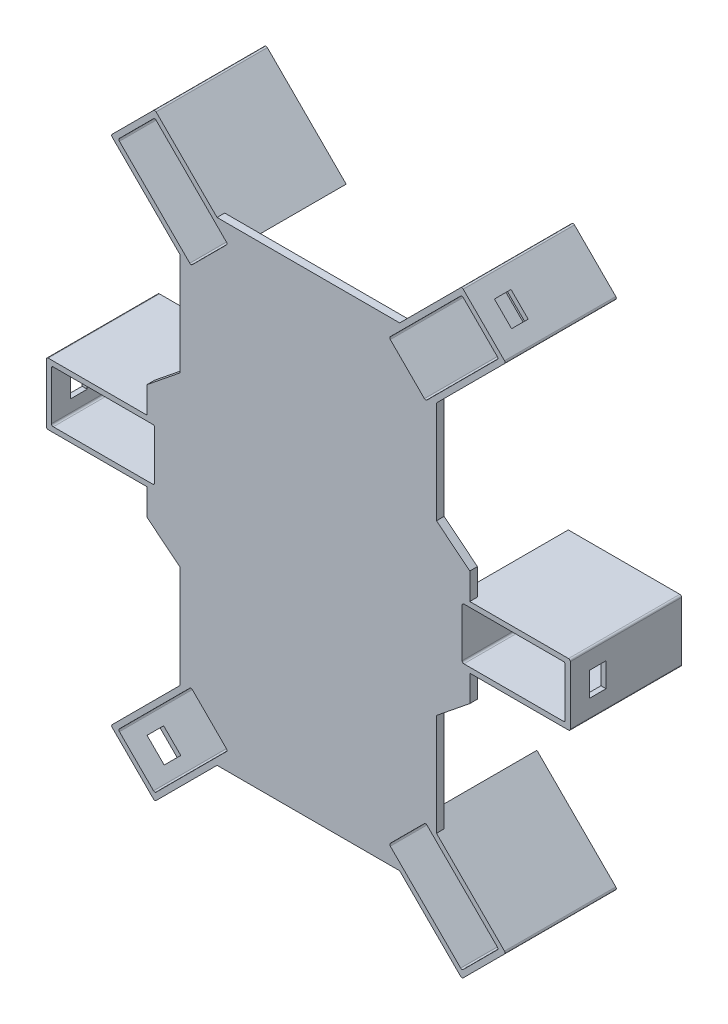
from build123d import *

# Parameters (mm, degrees)
SKETCH_1_W          = 44.4
SKETCH_1_H          = 24.3
SKETCH_1_W_2        = 40.4
SKETCH_1_H_2        = 20.3
EXTRUDE_5_DEPTH     = 42
EXTRUDE_5_2_DEPTH   = 42
EXTRUDE_6_DEPTH     = 42
EXTRUDE_6_2_DEPTH   = 42
EXTRUDE_6_3_DEPTH   = 42
EXTRUDE_6_4_DEPTH   = 42
SKETCH_6_R          = 6.75
SKETCH_6_R_2        = 0.8
SKETCH_6_W          = 44.4
SKETCH_6_H          = 24.3
EXTRUDE_8_DEPTH     = 1.6
FILLET_1_R          = 0.7
FILLET_2_R          = 0.7
FILLET_3_R          = 0.7
FILLET_4_R          = 0.7
FILLET_5_R          = 0.7
FILLET_6_R          = 0.7
SKETCH_7_R          = 2
CUT_EXTRUDE_2_DEPTH = 0.7
SKETCH_8_W          = 6.5
SKETCH_8_H          = 9.5
CUT_EXTRUDE_3_DEPTH = 9.8
SKETCH_9_W          = 6.5
SKETCH_9_H          = 9.5
CUT_EXTRUDE_4_DEPTH = 9.8
SKETCH_10_W         = 6.5
SKETCH_10_H         = 9.5
CUT_EXTRUDE_5_DEPTH = 9.8
SKETCH_11_W         = 6.5
SKETCH_11_H         = 9.5
CUT_EXTRUDE_6_DEPTH = 9.8
SKETCH_12_W         = 6.5
SKETCH_12_H         = 9.5
CUT_EXTRUDE_7_DEPTH = 9.8
SKETCH_13_W         = 6.5
SKETCH_13_H         = 9.5
CUT_EXTRUDE_8_DEPTH = 9.8
FILLET_7_R          = 0.7
FILLET_8_R          = 0.7
FILLET_9_R          = 0.7
FILLET_10_R         = 0.7
FILLET_11_R         = 0.7
FILLET_12_R         = 0.7
EXTRUDE_9_DEPTH     = 3
EXTRUDE_11_DEPTH    = 3
EXTRUDE_12_DEPTH    = 3
EXTRUDE_START       = -3
EXTRUDE_13_DEPTH    = 3


with BuildPart() as part:
    # 草图1 → 凸台-拉伸5 (new body)
    with BuildSketch(Plane.XY):
        with Locations((80.45, 0)):
            Rectangle(SKETCH_1_W, SKETCH_1_H)
        with Locations((80.45, 0)):
            Rectangle(SKETCH_1_W_2, SKETCH_1_H_2, mode=Mode.SUBTRACT)
    extrude(amount=EXTRUDE_5_DEPTH)



with BuildPart() as body_2:
    # 草图1 → Extrude 5 2 (new body)
    with BuildSketch(Plane.XY):
        with Locations((-80.45, 0)):
            Rectangle(SKETCH_1_W, SKETCH_1_H)
        with Locations((-80.45, 0)):
            Rectangle(SKETCH_1_W_2, SKETCH_1_H_2, mode=Mode.SUBTRACT)
    extrude(amount=EXTRUDE_5_2_DEPTH)


with BuildPart() as body_3:
    # 草图5 → 凸台-拉伸6 (new body)
    with BuildSketch(Plane.XY):
        Polygon((28.782128445, 85.964823228), (60.17766953, 117.360364312), (77.360364312, 100.17766953), (45.964823228, 68.782128445), align=None)
        Polygon((60.17766953, 114.531937188), (74.531937188, 100.17766953), (45.964823228, 71.61055557), (31.61055557, 85.964823228), align=None, mode=Mode.SUBTRACT)
    extrude(amount=EXTRUDE_6_DEPTH)


with BuildPart() as body_4:
    # 草图5 → Extrude 6 2 (new body)
    with BuildSketch(Plane.XY):
        Polygon((45.964823228, -68.782128445), (28.782128445, -85.964823228), (60.17766953, -117.360364312), (77.360364312, -100.17766953), align=None)
        Polygon((31.61055557, -85.964823228), (60.17766953, -114.531937188), (74.531937188, -100.17766953), (45.964823228, -71.61055557), align=None, mode=Mode.SUBTRACT)
    extrude(amount=EXTRUDE_6_2_DEPTH)


with BuildPart() as body_5:
    # 草图5 → Extrude 6 3 (new body)
    with BuildSketch(Plane.XY):
        Polygon((-28.782128445, -85.964823228), (-60.17766953, -117.360364312), (-77.360364312, -100.17766953), (-45.964823228, -68.782128445), align=None)
        Polygon((-60.17766953, -114.531937188), (-74.531937188, -100.17766953), (-45.964823228, -71.61055557), (-31.61055557, -85.964823228), align=None, mode=Mode.SUBTRACT)
    extrude(amount=EXTRUDE_6_3_DEPTH)


with BuildPart() as body_6:
    # 草图5 → Extrude 6 4 (new body)
    with BuildSketch(Plane.XY):
        Polygon((-45.964823228, 68.782128445), (-28.782128445, 85.964823228), (-60.17766953, 117.360364312), (-77.360364312, 100.17766953), align=None)
        Polygon((-31.61055557, 85.964823228), (-60.17766953, 114.531937188), (-74.531937188, 100.17766953), (-45.964823228, 71.61055557), align=None, mode=Mode.SUBTRACT)
    extrude(amount=EXTRUDE_6_4_DEPTH)


with BuildPart() as part_1:
    add(part.part)

    add(body_2.part)  # 凸台-拉伸8 merges body 2

    add(body_3.part)  # 凸台-拉伸8 merges body 3

    add(body_4.part)  # 凸台-拉伸8 merges body 4

    add(body_5.part)  # 凸台-拉伸8 merges body 5

    add(body_6.part)  # 凸台-拉伸8 merges body 6
    # 草图6 → 凸台-拉伸8 (add)
    # profile 1 of 6: a face of its own
    with BuildSketch(Plane(origin=(0, 0, 0), x_dir=(-1, 0, 0), z_dir=(0, 0, -1))):
        Polygon((-77.360364312, 100.17766953), (-60.17766953, 117.360364312), (-28.782128445, 85.964823228), (-45.964823228, 68.782128445), align=None)
        with Locations((-60.17766953, 100.17766953)):
            Circle(SKETCH_6_R, mode=Mode.SUBTRACT)
        with Locations((-61.026197667, 89.712489168)):
            Circle(SKETCH_6_R_2, mode=Mode.SUBTRACT)
        with Locations((-50.971139239, 81.071644302)):
            Circle(SKETCH_6_R_2, mode=Mode.SUBTRACT)
        with Locations((-41.071644302, 81.071644302)):
            Circle(SKETCH_6_R_2, mode=Mode.SUBTRACT)
        with Locations(Location((-41.071644302, 90.971139239, 0), (0, 0, 180))):
            Circle(SKETCH_6_R_2, mode=Mode.SUBTRACT)
        with Locations(Location((-49.712489168, 101.026197667, 0), (0, 0, 180))):
            Circle(SKETCH_6_R_2, mode=Mode.SUBTRACT)
    # profile 2 of 6: a face of its own
    with BuildSketch(Plane(origin=(0, 0, 0), x_dir=(-1, 0, 0), z_dir=(0, 0, -1))):
        with Locations((-80.45, 0)):
            Rectangle(SKETCH_6_W, SKETCH_6_H)
        with Locations((-70.48, -7)):
            Circle(SKETCH_6_R_2, mode=Mode.SUBTRACT)
        with Locations((-63.48, 0)):
            Circle(SKETCH_6_R_2, mode=Mode.SUBTRACT)
        with Locations((-90.5, 0)):
            Circle(SKETCH_6_R, mode=Mode.SUBTRACT)
        with Locations((-83.7, -8)):
            Circle(SKETCH_6_R_2, mode=Mode.SUBTRACT)
        with Locations(Location((-70.48, 7, 0), (0, 0, 180))):
            Circle(SKETCH_6_R_2, mode=Mode.SUBTRACT)
        with Locations(Location((-83.7, 8, 0), (0, 0, 180))):
            Circle(SKETCH_6_R_2, mode=Mode.SUBTRACT)
    # profile 3 of 6: a face of its own
    with BuildSketch(Plane(origin=(0, 0, 0), x_dir=(-1, 0, 0), z_dir=(0, 0, -1))):
        Polygon((-45.964823228, -68.782128445), (-77.360364312, -100.17766953), (-60.17766953, -117.360364312), (-28.782128445, -85.964823228), align=None)
        with Locations((-49.712489168, -101.026197667)):
            Circle(SKETCH_6_R_2, mode=Mode.SUBTRACT)
        with Locations((-41.071644302, -90.971139239)):
            Circle(SKETCH_6_R_2, mode=Mode.SUBTRACT)
        with Locations(Location((-41.071644302, -81.071644302, 0), (0, 0, 180))):
            Circle(SKETCH_6_R_2, mode=Mode.SUBTRACT)
        with Locations(Location((-50.971139239, -81.071644302, 0), (0, 0, 180))):
            Circle(SKETCH_6_R_2, mode=Mode.SUBTRACT)
        with Locations(Location((-61.026197667, -89.712489168, 0), (0, 0, 180))):
            Circle(SKETCH_6_R_2, mode=Mode.SUBTRACT)
        with Locations(Location((-60.17766953, -100.17766953, 0), (0, 0, 180))):
            Circle(SKETCH_6_R, mode=Mode.SUBTRACT)
    # profile 4 of 6: a face of its own
    with BuildSketch(Plane(origin=(0, 0, 0), x_dir=(-1, 0, 0), z_dir=(0, 0, -1))):
        Polygon((77.360364312, -100.17766953), (60.17766953, -117.360364312), (28.782128445, -85.964823228), (45.964823228, -68.782128445), align=None)
        with Locations((60.17766953, -100.17766953)):
            Circle(SKETCH_6_R, mode=Mode.SUBTRACT)
        with Locations((61.026197667, -89.712489168)):
            Circle(SKETCH_6_R_2, mode=Mode.SUBTRACT)
        with Locations((50.971139239, -81.071644302)):
            Circle(SKETCH_6_R_2, mode=Mode.SUBTRACT)
        with Locations((41.071644302, -81.071644302)):
            Circle(SKETCH_6_R_2, mode=Mode.SUBTRACT)
        with Locations(Location((41.071644302, -90.971139239, 0), (0, 0, 180))):
            Circle(SKETCH_6_R_2, mode=Mode.SUBTRACT)
        with Locations(Location((49.712489168, -101.026197667, 0), (0, 0, 180))):
            Circle(SKETCH_6_R_2, mode=Mode.SUBTRACT)
    # profile 5 of 6: a face of its own
    with BuildSketch(Plane(origin=(0, 0, 0), x_dir=(-1, 0, 0), z_dir=(0, 0, -1))):
        with Locations((80.45, 0)):
            Rectangle(SKETCH_6_W, SKETCH_6_H)
        with Locations((83.7, 8)):
            Circle(SKETCH_6_R_2, mode=Mode.SUBTRACT)
        with Locations((70.48, 7)):
            Circle(SKETCH_6_R_2, mode=Mode.SUBTRACT)
        with Locations(Location((83.7, -8, 0), (0, 0, 180))):
            Circle(SKETCH_6_R_2, mode=Mode.SUBTRACT)
        with Locations(Location((90.5, 0, 0), (0, 0, 180))):
            Circle(SKETCH_6_R, mode=Mode.SUBTRACT)
        with Locations(Location((63.48, 0, 0), (0, 0, 180))):
            Circle(SKETCH_6_R_2, mode=Mode.SUBTRACT)
        with Locations(Location((70.48, -7, 0), (0, 0, 180))):
            Circle(SKETCH_6_R_2, mode=Mode.SUBTRACT)
    # profile 6 of 6: a face of its own
    with BuildSketch(Plane(origin=(0, 0, 0), x_dir=(-1, 0, 0), z_dir=(0, 0, -1))):
        Polygon((45.964823228, 68.782128445), (77.360364312, 100.17766953), (60.17766953, 117.360364312), (28.782128445, 85.964823228), align=None)
        with Locations((49.712489168, 101.026197667)):
            Circle(SKETCH_6_R_2, mode=Mode.SUBTRACT)
        with Locations((41.071644302, 90.971139239)):
            Circle(SKETCH_6_R_2, mode=Mode.SUBTRACT)
        with Locations(Location((41.071644302, 81.071644302, 0), (0, 0, 180))):
            Circle(SKETCH_6_R_2, mode=Mode.SUBTRACT)
        with Locations(Location((50.971139239, 81.071644302, 0), (0, 0, 180))):
            Circle(SKETCH_6_R_2, mode=Mode.SUBTRACT)
        with Locations(Location((61.026197667, 89.712489168, 0), (0, 0, 180))):
            Circle(SKETCH_6_R_2, mode=Mode.SUBTRACT)
        with Locations(Location((60.17766953, 100.17766953, 0), (0, 0, 180))):
            Circle(SKETCH_6_R, mode=Mode.SUBTRACT)
    extrude(amount=EXTRUDE_8_DEPTH)

    # 圆角1
    fillet_1_edges = [part_1.edges().sort_by_distance(p)[0] for p in [
        (60.17766953, 114.531937188, 21),
        (31.61055557, 85.964823228, 21),
        (45.964823228, 71.61055557, 21),
        (74.531937188, 100.17766953, 21),
    ]]
    fillet(fillet_1_edges, radius=FILLET_1_R)

    # 圆角2
    fillet_2_edges = [part_1.edges().sort_by_distance(p)[0] for p in [
        (-60.17766953, 114.531937188, 21),
        (-74.531937188, 100.17766953, 21),
        (-45.964823228, 71.61055557, 21),
        (-31.61055557, 85.964823228, 21),
    ]]
    fillet(fillet_2_edges, radius=FILLET_2_R)

    # 圆角3
    fillet_3_edges = [part_1.edges().sort_by_distance(p)[0] for p in [
        (-100.65, 10.15, 21),
        (-100.65, -10.15, 21),
        (-60.25, -10.15, 21),
        (-60.25, 10.15, 21),
    ]]
    fillet(fillet_3_edges, radius=FILLET_3_R)

    # 圆角4
    fillet_4_edges = [part_1.edges().sort_by_distance(p)[0] for p in [
        (-60.17766953, -114.531937188, 21),
        (-31.61055557, -85.964823228, 21),
        (-45.964823228, -71.61055557, 21),
        (-74.531937188, -100.17766953, 21),
    ]]
    fillet(fillet_4_edges, radius=FILLET_4_R)

    # 圆角5
    fillet_5_edges = [part_1.edges().sort_by_distance(p)[0] for p in [
        (60.17766953, -114.531937188, 21),
        (74.531937188, -100.17766953, 21),
        (45.964823228, -71.61055557, 21),
        (31.61055557, -85.964823228, 21),
    ]]
    fillet(fillet_5_edges, radius=FILLET_5_R)

    # 圆角6
    fillet_6_edges = [part_1.edges().sort_by_distance(p)[0] for p in [
        (60.25, 10.15, 21),
        (60.25, -10.15, 21),
        (100.65, -10.15, 21),
        (100.65, 10.15, 21),
    ]]
    fillet(fillet_6_edges, radius=FILLET_6_R)

    # 草图7 → 切除-拉伸2 (cut)
    with BuildSketch(Plane(origin=(0, 0, -1.6), x_dir=(-1, 0, 0), z_dir=(0, 0, -1))):
        with Locations((83.7, 8)):
            Circle(SKETCH_7_R)
        with Locations((83.7, -8)):
            Circle(SKETCH_7_R)
        with Locations((61.026197667, -89.712489168)):
            Circle(SKETCH_7_R)
        with Locations((49.712489168, -101.026197667)):
            Circle(SKETCH_7_R)
        with Locations(Location((-49.712489168, -101.026197667, 0), (0, 0, 180))):
            Circle(SKETCH_7_R)
        with Locations(Location((-61.026197667, -89.712489168, 0), (0, 0, 180))):
            Circle(SKETCH_7_R)
        with Locations(Location((-83.7, -8, 0), (0, 0, 180))):
            Circle(SKETCH_7_R)
        with Locations(Location((-83.7, 8, 0), (0, 0, 180))):
            Circle(SKETCH_7_R)
        with Locations((-61.026197667, 89.712489168)):
            Circle(SKETCH_7_R)
        with Locations((-49.712489168, 101.026197667)):
            Circle(SKETCH_7_R)
        with Locations((49.712489168, 101.026197667)):
            Circle(SKETCH_7_R)
        with Locations((61.026197667, 89.712489168)):
            Circle(SKETCH_7_R)
    extrude(amount=-CUT_EXTRUDE_2_DEPTH, mode=Mode.SUBTRACT)

    # 草图8 → 切除-拉伸3 (cut)
    with BuildSketch(Plane(origin=(-88.769016921, -88.769016921, 0), x_dir=(0, 0, 1), z_dir=(-0.7071067811865477, -0.7071067811865475, 0))):
        with Locations((31.25, -28.284271247)):
            Rectangle(SKETCH_8_W, SKETCH_8_H)
    extrude(amount=-CUT_EXTRUDE_3_DEPTH, mode=Mode.SUBTRACT)

    # 草图9 → 切除-拉伸4 (cut)
    with BuildSketch(Plane.ZY.offset(102.65)):
        with Locations((31.25, 0)):
            Rectangle(SKETCH_9_W, SKETCH_9_H)
    extrude(amount=-CUT_EXTRUDE_4_DEPTH, mode=Mode.SUBTRACT)

    # 草图10 → 切除-拉伸5 (cut)
    with BuildSketch(Plane(origin=(-88.769016921, 88.769016921, 0), x_dir=(0, 0, 1), z_dir=(-0.7071067811865477, 0.7071067811865475, 0))):
        with Locations((31.25, 28.305878323)):
            Rectangle(SKETCH_10_W, SKETCH_10_H)
    extrude(amount=-CUT_EXTRUDE_5_DEPTH, mode=Mode.SUBTRACT)

    # 草图11 → 切除-拉伸6 (cut)
    with BuildSketch(Plane(origin=(88.769016921, 88.769016921, 0), x_dir=(0, 0, -1), z_dir=(0.7071067811865477, 0.7071067811865475, 0))):
        with Locations((-31.25, 28.284271247)):
            Rectangle(SKETCH_11_W, SKETCH_11_H)
    extrude(amount=-CUT_EXTRUDE_6_DEPTH, mode=Mode.SUBTRACT)

    # 草图12 → 切除-拉伸7 (cut)
    with BuildSketch(Plane(origin=(102.65, 0, 0), x_dir=(0, 0, -1), z_dir=(1, 0, 0))):
        with Locations((-31.25, 0)):
            Rectangle(SKETCH_12_W, SKETCH_12_H)
    extrude(amount=-CUT_EXTRUDE_7_DEPTH, mode=Mode.SUBTRACT)

    # 草图13 → 切除-拉伸8 (cut)
    with BuildSketch(Plane(origin=(88.769016921, -88.769016921, 0), x_dir=(0, 0, -1), z_dir=(0.7071067811865477, -0.7071067811865475, 0))):
        with Locations((-31.25, -28.284271247)):
            Rectangle(SKETCH_13_W, SKETCH_13_H)
    extrude(amount=-CUT_EXTRUDE_8_DEPTH, mode=Mode.SUBTRACT)

    # 圆角7
    fillet_7_edges = [part_1.edges().sort_by_distance(p)[0] for p in [
        (-77.360364312, 100.17766953, 20.2),
        (-60.17766953, 117.360364312, 20.2),
    ]]
    fillet(fillet_7_edges, radius=FILLET_7_R)

    # 圆角8
    fillet_8_edges = [part_1.edges().sort_by_distance(p)[0] for p in [
        (-102.65, -12.15, 20.2),
        (-102.65, 12.15, 20.2),
    ]]
    fillet(fillet_8_edges, radius=FILLET_8_R)

    # 圆角9
    fillet_9_edges = [part_1.edges().sort_by_distance(p)[0] for p in [
        (-60.17766953, -117.360364312, 20.2),
        (-77.360364312, -100.17766953, 20.2),
    ]]
    fillet(fillet_9_edges, radius=FILLET_9_R)

    # 圆角10
    fillet_10_edges = [part_1.edges().sort_by_distance(p)[0] for p in [
        (77.360364312, -100.17766953, 20.2),
        (60.17766953, -117.360364312, 20.2),
    ]]
    fillet(fillet_10_edges, radius=FILLET_10_R)

    # 圆角11
    fillet_11_edges = [part_1.edges().sort_by_distance(p)[0] for p in [
        (102.65, 12.15, 20.2),
        (102.65, -12.15, 20.2),
    ]]
    fillet(fillet_11_edges, radius=FILLET_11_R)

    # 圆角12
    fillet_12_edges = [part_1.edges().sort_by_distance(p)[0] for p in [
        (60.17766953, 117.360364312, 20.2),
        (77.360364312, 100.17766953, 20.2),
    ]]
    fillet(fillet_12_edges, radius=FILLET_12_R)

    # 草图14 → 凸台-拉伸9 (add)
    with BuildSketch(Plane.XY.offset(42)):
        Polygon((58.25, 12.15), (42.5, 24.862562051), (42.5, 65.317305217), (45.964823228, 68.782128445), (28.782128445, 85.964823228), (25.317305217, 82.5), (-25.317305217, 82.5), (-28.782128445, 85.964823228), (-45.964823228, 68.782128445), (-42.5, 65.317305217), (-42.5, 24.862562051), (-58.25, 12.15), (-58.25, -12.15), (-42.5, -24.862562051), (-42.5, -65.317305217), (-45.964823228, -68.782128445), (-28.782128445, -85.964823228), (-25.317305217, -82.5), (25.317305217, -82.5), (28.782128445, -85.964823228), (45.964823228, -68.782128445), (42.5, -65.317305217), (42.5, -24.862562051), (58.25, -12.15), align=None)
    extrude(amount=-EXTRUDE_9_DEPTH)

    # 草图19 → 凸台-拉伸11 (add)
    with BuildSketch(Plane(origin=(0, 0, 39), x_dir=(-1, 0, 0), z_dir=(0, 0, -1))):
        Polygon((-50.207463915, 73.024769132), (-50.207463915, 33.024769132), (-58.25, 26.533261892), (-58.25, 12.15), (-58.25, -12.15), (-58.25, -26.533261892), (-50.207463915, -33.024769132), (-50.207463915, -73.024769132), (-45.964823228, -68.782128445), (-28.782128445, -85.964823228), (28.782128445, -85.964823228), (45.964823228, -68.782128445), (50.207463915, -73.024769132), (50.207463915, -33.024769132), (58.25, -26.533261892), (58.25, -12.15), (58.25, 12.15), (58.25, 26.533261892), (50.207463915, 33.024769132), (50.207463915, 73.024769132), (45.964823228, 68.782128445), (28.782128445, 85.964823228), (-28.782128445, 85.964823228), (-45.964823228, 68.782128445), align=None)
    extrude(amount=-EXTRUDE_11_DEPTH)

    # 草图20 → 凸台-拉伸12 (add)
    with BuildSketch(Plane(origin=(0, 0, 39), x_dir=(-1, 0, 0), z_dir=(0, 0, -1))):
        Polygon((-28.782128445, 85.964823228), (-35.782128445, 92.964823228), (35.782128445, 92.964823228), (28.782128445, 85.964823228), align=None)
        Polygon((-28.782128445, -85.964823228), (-35.782128445, -92.964823228), (35.782128445, -92.964823228), (28.782128445, -85.964823228), align=None)
    extrude(amount=-EXTRUDE_12_DEPTH)

    # 草图21 → 凸台-拉伸13 (add)
    with BuildSketch(Plane.XY.offset(42).offset(EXTRUDE_START)):
        Polygon((-58.25, 26.533261892), (-63.25, 22.497527908), (-63.25, 12.15), (-58.25, 12.15), align=None)
        Polygon((-63.25, -22.497527908), (-63.25, -12.15), (-58.25, -12.15), (-58.25, -26.533261892), align=None)
        Polygon((58.25, -26.533261892), (63.25, -22.497527908), (63.25, -12.15), (58.25, -12.15), align=None)
        Polygon((58.25, 12.15), (58.25, 26.533261892), (63.25, 22.497527908), (63.25, 12.15), align=None)
    extrude(amount=EXTRUDE_13_DEPTH)


solid = part_1.part
